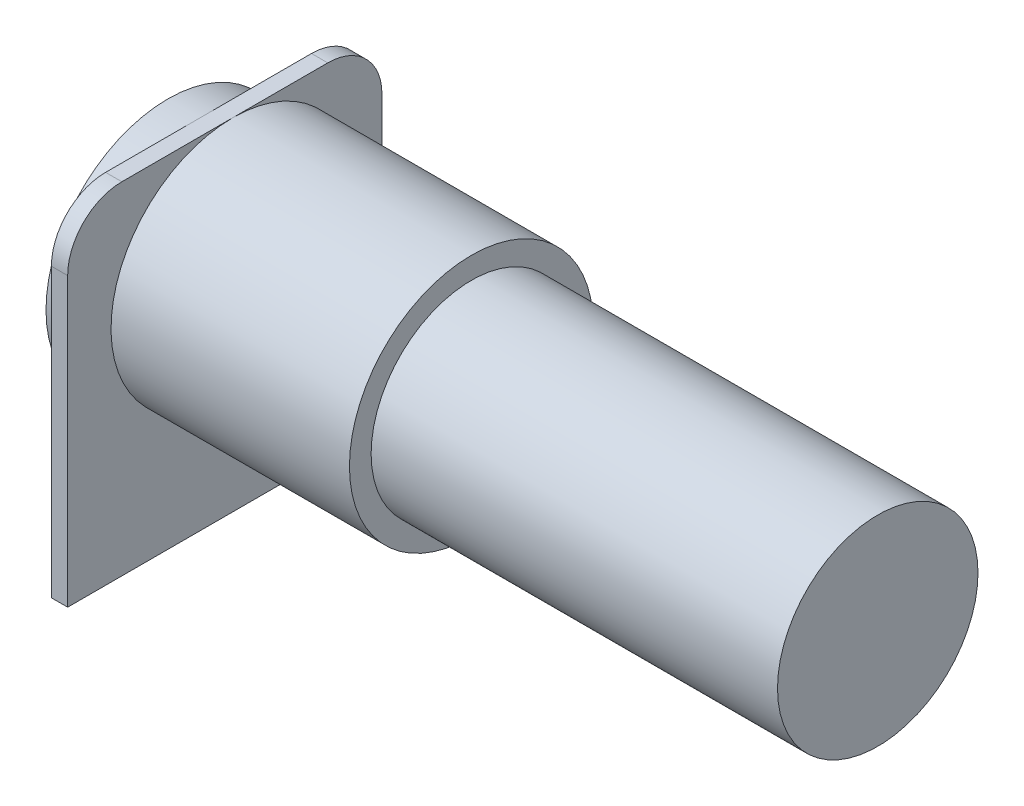
from build123d import *

# Parameters (mm, degrees)
BOSS_EXTRUDE1_DEPTH = 3
SKETCH2_R           = 22.5
BOSS_EXTRUDE2_DEPTH = 44
SKETCH3_R           = 18.5
BOSS_EXTRUDE3_DEPTH = 75
SKETCH4_R           = 22.5
BOSS_EXTRUDE4_DEPTH = 6
SKETCH5_R           = 3
BOSS_EXTRUDE5_DEPTH = 7.5


with BuildPart() as part:
    # Sketch1 → Boss-Extrude1 (new body)
    with BuildSketch(Plane(origin=(0, 0, 0), x_dir=(0, 0, -1), z_dir=(1, 0, 0))):
        with BuildLine():
            Line((-10, -1.222482436), (-48, -1.222482436))
            ThreePointArc((-48, -1.222482436), (-55.071067812, -4.151414624), (-58, -11.222482436))
            Line((-58, -11.222482436), (-58, -64.222482436))
            Line((-58, -64.222482436), (0, -64.222482436))
            Line((0, -64.222482436), (0, -11.222482436))
            ThreePointArc((0, -11.222482436), (-2.928932188, -4.151414624), (-10, -1.222482436))
        make_face()
    extrude(amount=BOSS_EXTRUDE1_DEPTH)

    # Sketch2 → Boss-Extrude2 (add)
    with BuildSketch(Plane(origin=(3, 0, 0), x_dir=(0, 0, -1), z_dir=(1, 0, 0))):
        with Locations(Location((-27.5, -23.722482436, 0), (0, 0, 90))):
            Circle(SKETCH2_R)
    extrude(amount=BOSS_EXTRUDE2_DEPTH)

    # Sketch3 → Boss-Extrude3 (add)
    with BuildSketch(Plane(origin=(47, 0, 0), x_dir=(0, 0, -1), z_dir=(1, 0, 0))):
        with Locations((-27.5, -23.722482436)):
            Circle(SKETCH3_R)
    extrude(amount=BOSS_EXTRUDE3_DEPTH)

    # Sketch4 → Boss-Extrude4 (add)
    with BuildSketch(Plane.ZY):
        with Locations(Location((30.5, -23.722482436, 0), (0, 0, 90))):
            Circle(SKETCH4_R)
    extrude(amount=BOSS_EXTRUDE4_DEPTH)

    # Sketch5 → Boss-Extrude5 (add)
    with BuildSketch(Plane.ZY.offset(6)):
        with Locations((30.5, -23.722482436)):
            Circle(SKETCH5_R)
    extrude(amount=BOSS_EXTRUDE5_DEPTH)


solid = part.part
